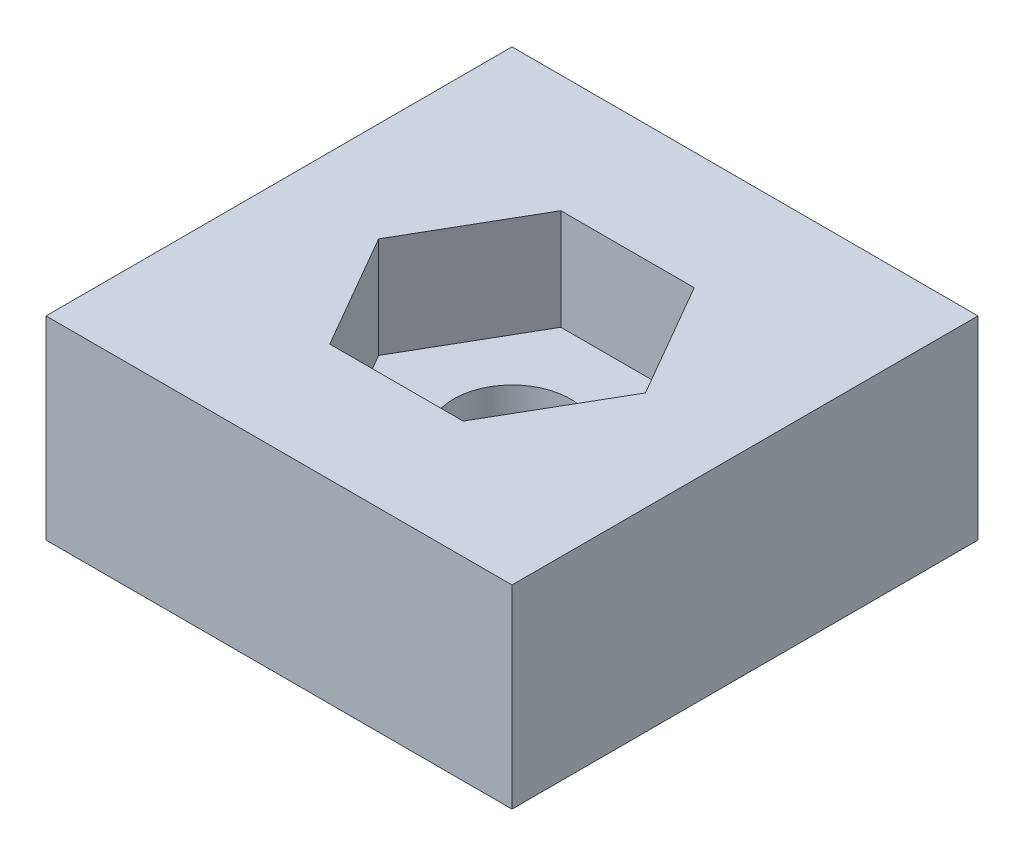
from build123d import *

# Parameters (mm, degrees)
SKETCH1_W           = 12
SKETCH1_H           = 12
BOSS_EXTRUDE1_DEPTH = 5
SKETCH2_R           = 1.5
CUT_EXTRUDE1_DEPTH  = 5
CUT_EXTRUDE2_DEPTH  = 2.6


with BuildPart() as part:
    # Sketch1 → Boss-Extrude1 (new body)
    with BuildSketch(Plane(origin=(0, 0, 0), x_dir=(1, 0, 0), z_dir=(0, 1, 0))):
        Rectangle(SKETCH1_W, SKETCH1_H)
    extrude(amount=BOSS_EXTRUDE1_DEPTH)

    # Sketch2 → Cut-Extrude1 (cut)
    with BuildSketch(Plane(origin=(0, 5, 0), x_dir=(1, 0, 0), z_dir=(0, 1, 0))):
        with Locations(Location((0, 0, 0), (0, 0, 270))):
            Circle(SKETCH2_R)
    extrude(amount=-CUT_EXTRUDE1_DEPTH, mode=Mode.SUBTRACT)

    # Sketch3 → Cut-Extrude2 (cut)
    with BuildSketch(Plane(origin=(0, 5, 0), x_dir=(1, 0, 0), z_dir=(0, 1, 0))):
        Polygon((3.435234102, 0), (1.717617051, 2.975), (-1.717617051, 2.975), (-3.435234102, 0), (-1.717617051, -2.975), (1.717617051, -2.975), align=None)
    extrude(amount=-CUT_EXTRUDE2_DEPTH, mode=Mode.SUBTRACT)


solid = part.part
